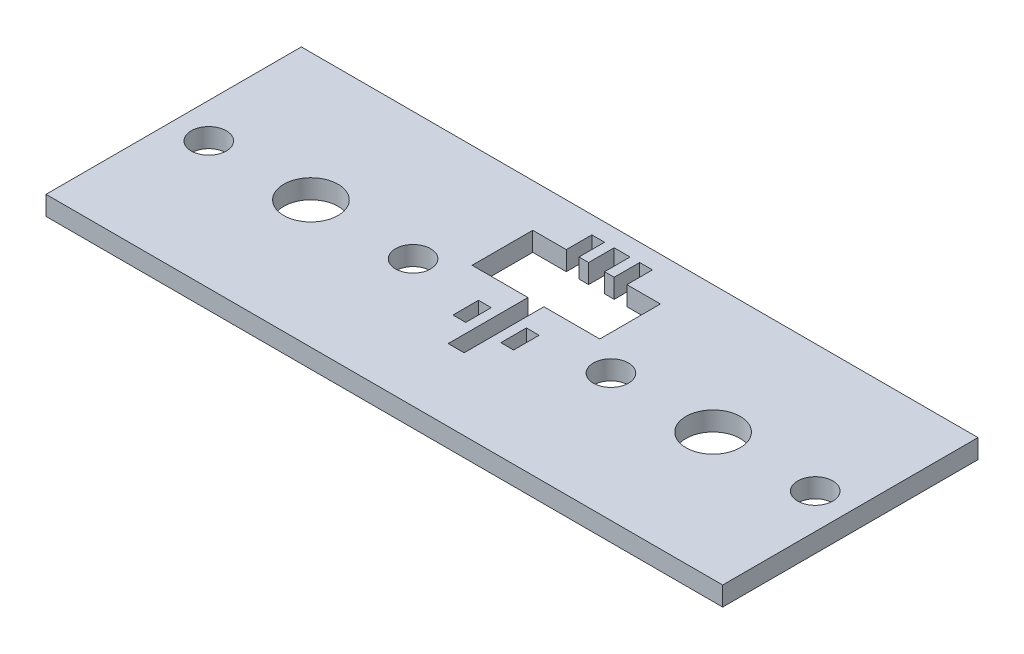
from build123d import *

# Parameters (mm, degrees)
SKETCH_1_W          = 106
SKETCH_1_H          = 40
EXTRUDE_1_DEPTH     = 3
CUT_EXTRUDE_1_REACH = 58.727
SKETCH_2_R          = 4.25
SKETCH_2_R_2        = 2.75
CUT_EXTRUDE_2_REACH = 58.727
CUT_EXTRUDE_3_REACH = 58.727
SKETCH_4_W          = 2
SKETCH_4_H          = 4


with BuildPart() as part:
    # 草图1 → 凸台-拉伸1 (new body)
    with BuildSketch(Plane(origin=(0, 0, 0), x_dir=(1, 0, 0), z_dir=(0, 1, 0))):
        Rectangle(SKETCH_1_W, SKETCH_1_H)
    extrude(amount=EXTRUDE_1_DEPTH)

    # 草图2 → 切除-拉伸1 (cut, up to next)
    with BuildSketch(Plane(origin=(0, 3, 0), x_dir=(1, 0, 0), z_dir=(0, 1, 0)), mode=Mode.PRIVATE) as cut_extrude_1_sk1:
        with Locations(Location((-31.5, 0, 0), (0, 0, 270))):
            Circle(SKETCH_2_R)
    cut_extrude_1_tool1 = extrude(cut_extrude_1_sk1.sketch, amount=-CUT_EXTRUDE_1_REACH, mode=Mode.PRIVATE) & part.part
    # 草图2 → 切除-拉伸1 (cut, up to next)
    with BuildSketch(Plane(origin=(0, 3, 0), x_dir=(1, 0, 0), z_dir=(0, 1, 0)), mode=Mode.PRIVATE) as cut_extrude_1_sk2:
        with Locations(Location((31.5, 0, 0), (0, 0, 270))):
            Circle(SKETCH_2_R)
    cut_extrude_1_tool2 = extrude(cut_extrude_1_sk2.sketch, amount=-CUT_EXTRUDE_1_REACH, mode=Mode.PRIVATE) & part.part
    # 草图2 → 切除-拉伸1 (cut, up to next)
    with BuildSketch(Plane(origin=(0, 3, 0), x_dir=(1, 0, 0), z_dir=(0, 1, 0)), mode=Mode.PRIVATE) as cut_extrude_1_sk3:
        with Locations(Location((-47.5, 0, 0), (0, 0, 270))):
            Circle(SKETCH_2_R_2)
    cut_extrude_1_tool3 = extrude(cut_extrude_1_sk3.sketch, amount=-CUT_EXTRUDE_1_REACH, mode=Mode.PRIVATE) & part.part
    # 草图2 → 切除-拉伸1 (cut, up to next)
    with BuildSketch(Plane(origin=(0, 3, 0), x_dir=(1, 0, 0), z_dir=(0, 1, 0)), mode=Mode.PRIVATE) as cut_extrude_1_sk4:
        with Locations(Location((-15.5, 0, 0), (0, 0, 270))):
            Circle(SKETCH_2_R_2)
    cut_extrude_1_tool4 = extrude(cut_extrude_1_sk4.sketch, amount=-CUT_EXTRUDE_1_REACH, mode=Mode.PRIVATE) & part.part
    # 草图2 → 切除-拉伸1 (cut, up to next)
    with BuildSketch(Plane(origin=(0, 3, 0), x_dir=(1, 0, 0), z_dir=(0, 1, 0)), mode=Mode.PRIVATE) as cut_extrude_1_sk5:
        with Locations(Location((15.5, 0, 0), (0, 0, 270))):
            Circle(SKETCH_2_R_2)
    cut_extrude_1_tool5 = extrude(cut_extrude_1_sk5.sketch, amount=-CUT_EXTRUDE_1_REACH, mode=Mode.PRIVATE) & part.part
    # 草图2 → 切除-拉伸1 (cut, up to next)
    with BuildSketch(Plane(origin=(0, 3, 0), x_dir=(1, 0, 0), z_dir=(0, 1, 0)), mode=Mode.PRIVATE) as cut_extrude_1_sk6:
        with Locations(Location((47.5, 0, 0), (0, 0, 270))):
            Circle(SKETCH_2_R_2)
    cut_extrude_1_tool6 = extrude(cut_extrude_1_sk6.sketch, amount=-CUT_EXTRUDE_1_REACH, mode=Mode.PRIVATE) & part.part
    add(cut_extrude_1_tool1.solids().sort_by_distance((-31.5, 3, 0))[0], mode=Mode.SUBTRACT)
    add(cut_extrude_1_tool2.solids().sort_by_distance((31.5, 3, 0))[0], mode=Mode.SUBTRACT)
    add(cut_extrude_1_tool3.solids().sort_by_distance((-47.5, 3, 0))[0], mode=Mode.SUBTRACT)
    add(cut_extrude_1_tool4.solids().sort_by_distance((-15.5, 3, 0))[0], mode=Mode.SUBTRACT)
    add(cut_extrude_1_tool5.solids().sort_by_distance((15.5, 3, 0))[0], mode=Mode.SUBTRACT)
    add(cut_extrude_1_tool6.solids().sort_by_distance((47.5, 3, 0))[0], mode=Mode.SUBTRACT)

    # 草图3 → 切除-拉伸2 (cut, up to next)
    with BuildSketch(Plane(origin=(0, 3, 0), x_dir=(1, 0, 0), z_dir=(0, 1, 0)), mode=Mode.PRIVATE) as cut_extrude_2_sk1:
        Polygon((1.25, 13.25), (10, 13.25), (10, 3.75), (1.25, 3.75), (1.25, -8.75), (-1.25, -8.75), (-1.25, 3.75), (-10, 3.75), (-10, 13.25), (-1.25, 13.25), (-1.25, 17.25), (1.25, 17.25), align=None)
    cut_extrude_2_tool1 = extrude(cut_extrude_2_sk1.sketch, amount=-CUT_EXTRUDE_2_REACH, mode=Mode.PRIVATE) & part.part
    add(cut_extrude_2_tool1.solids().sort_by_distance((0, 3, -7.305405))[0], mode=Mode.SUBTRACT)

    # 草图4 → 切除-拉伸3 (cut, up to next)
    with BuildSketch(Plane(origin=(0, 3, 0), x_dir=(1, 0, 0), z_dir=(0, 1, 0)), mode=Mode.PRIVATE) as cut_extrude_3_sk1:
        with Locations((-3.75, 15.25)):
            Rectangle(SKETCH_4_W, SKETCH_4_H)
    cut_extrude_3_tool1 = extrude(cut_extrude_3_sk1.sketch, amount=-CUT_EXTRUDE_3_REACH, mode=Mode.PRIVATE) & part.part
    # 草图4 → 切除-拉伸3 (cut, up to next)
    with BuildSketch(Plane(origin=(0, 3, 0), x_dir=(1, 0, 0), z_dir=(0, 1, 0)), mode=Mode.PRIVATE) as cut_extrude_3_sk2:
        with Locations((3.75, 15.25)):
            Rectangle(SKETCH_4_W, SKETCH_4_H)
    cut_extrude_3_tool2 = extrude(cut_extrude_3_sk2.sketch, amount=-CUT_EXTRUDE_3_REACH, mode=Mode.PRIVATE) & part.part
    # 草图4 → 切除-拉伸3 (cut, up to next)
    with BuildSketch(Plane(origin=(0, 3, 0), x_dir=(1, 0, 0), z_dir=(0, 1, 0)), mode=Mode.PRIVATE) as cut_extrude_3_sk3:
        with Locations((3.75, -2.5)):
            Rectangle(SKETCH_4_W, SKETCH_4_H)
    cut_extrude_3_tool3 = extrude(cut_extrude_3_sk3.sketch, amount=-CUT_EXTRUDE_3_REACH, mode=Mode.PRIVATE) & part.part
    # 草图4 → 切除-拉伸3 (cut, up to next)
    with BuildSketch(Plane(origin=(0, 3, 0), x_dir=(1, 0, 0), z_dir=(0, 1, 0)), mode=Mode.PRIVATE) as cut_extrude_3_sk4:
        with Locations((-3.75, -2.5)):
            Rectangle(SKETCH_4_W, SKETCH_4_H)
    cut_extrude_3_tool4 = extrude(cut_extrude_3_sk4.sketch, amount=-CUT_EXTRUDE_3_REACH, mode=Mode.PRIVATE) & part.part
    add(cut_extrude_3_tool1.solids().sort_by_distance((-3.75, 3, -15.25))[0], mode=Mode.SUBTRACT)
    add(cut_extrude_3_tool2.solids().sort_by_distance((3.75, 3, -15.25))[0], mode=Mode.SUBTRACT)
    add(cut_extrude_3_tool3.solids().sort_by_distance((3.75, 3, 2.5))[0], mode=Mode.SUBTRACT)
    add(cut_extrude_3_tool4.solids().sort_by_distance((-3.75, 3, 2.5))[0], mode=Mode.SUBTRACT)


solid = part.part
